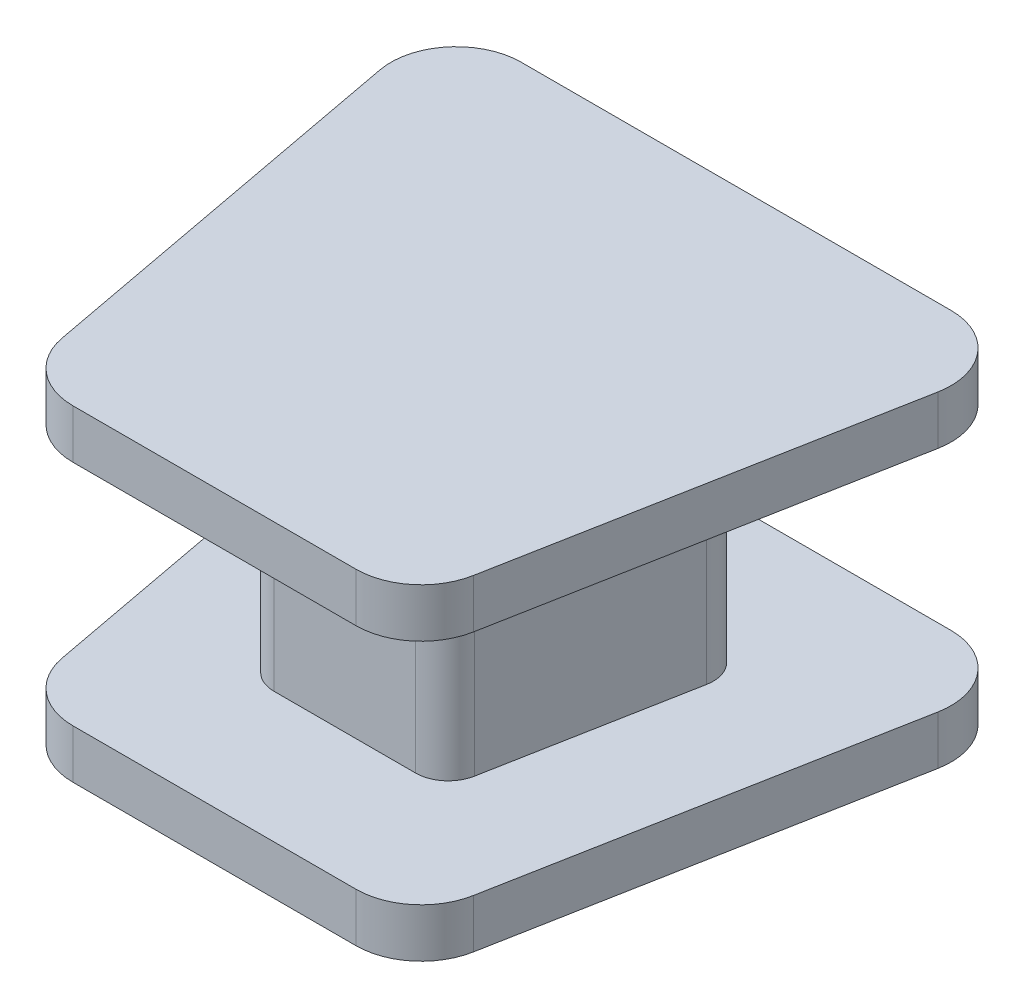
from build123d import *

# Parameters (mm, degrees)
BOSS_EXTRUDE1_DEPTH = 12.7
CUT_EXTRUDE1_DEPTH  = 8.89


with BuildPart() as part:
    # Sketch1 → Boss-Extrude1 (new, symmetric)
    with BuildSketch(Plane(origin=(0, 0, 0), x_dir=(1, 0, 0), z_dir=(0, 1, 0))):
        with BuildLine():
            Line((-16.738974461, 20.32), (16.738974461, 20.32))
            ThreePointArc((16.738974461, 20.32), (20.64808073, 18.484270053), (21.73196517, 14.303814242))
            Line((21.73196517, 14.303814242), (16.01696517, -16.176185758))
            ThreePointArc((16.01696517, -16.176185758), (14.268244513, -19.149106269), (11.023974461, -20.32))
            Line((11.023974461, -20.32), (-11.023974461, -20.32))
            ThreePointArc((-11.023974461, -20.32), (-14.268244513, -19.149106269), (-16.01696517, -16.176185758))
            Line((-16.01696517, -16.176185758), (-21.73196517, 14.303814242))
            ThreePointArc((-21.73196517, 14.303814242), (-20.64808073, 18.484270053), (-16.738974461, 20.32))
        make_face()
    extrude(amount=BOSS_EXTRUDE1_DEPTH, both=True)

    # Sketch3 → Cut-Extrude1 (cut, symmetric)
    with BuildSketch(Plane(origin=(0, 0, 0), x_dir=(1, 0, 0), z_dir=(0, 1, 0))):
        with BuildLine():
            Line((-16.738974461, 20.32), (16.738974461, 20.32))
            ThreePointArc((16.738974461, 20.32), (20.64808073, 18.484270053), (21.73196517, 14.303814242))
            Line((21.73196517, 14.303814242), (16.01696517, -16.176185758))
            ThreePointArc((16.01696517, -16.176185758), (14.268244513, -19.149106269), (11.023974461, -20.32))
            Line((11.023974461, -20.32), (-11.023974461, -20.32))
            ThreePointArc((-11.023974461, -20.32), (-14.268244513, -19.149106269), (-16.01696517, -16.176185758))
            Line((-16.01696517, -16.176185758), (-21.73196517, 14.303814242))
            ThreePointArc((-21.73196517, 14.303814242), (-20.64808073, 18.484270053), (-16.738974461, 20.32))
        make_face()
        with BuildLine():
            Line((5.51198723, -10.16), (-5.51198723, -10.16))
            ThreePointArc((-5.51198723, -10.16), (-7.134122257, -9.574553135), (-8.008482585, -8.088092879))
            Line((-8.008482585, -8.088092879), (-10.865982585, 7.151907121))
            ThreePointArc((-10.865982585, 7.151907121), (-10.324040365, 9.242135026), (-8.36948723, 10.16))
            Line((-8.36948723, 10.16), (8.36948723, 10.16))
            ThreePointArc((8.36948723, 10.16), (10.324040365, 9.242135026), (10.865982585, 7.151907121))
            Line((10.865982585, 7.151907121), (8.008482585, -8.088092879))
            ThreePointArc((8.008482585, -8.088092879), (7.134122257, -9.574553135), (5.51198723, -10.16))
        make_face(mode=Mode.SUBTRACT)
    extrude(amount=CUT_EXTRUDE1_DEPTH, both=True, mode=Mode.SUBTRACT)


solid = part.part
